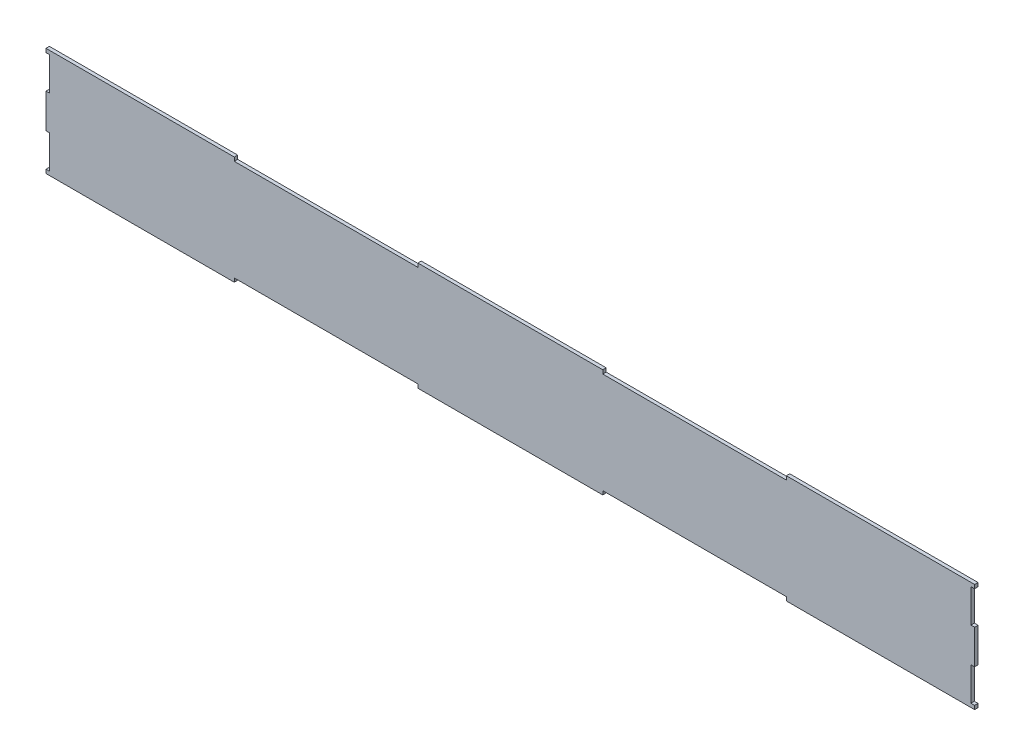
from build123d import *

# Parameters (mm, degrees)
BOSS_EXTRUDE1_DEPTH = 1.6


with BuildPart() as part:
    # Sketch1 → Boss-Extrude1 (new body)
    with BuildSketch(Plane.XY):
        Polygon((-218.4266645, 25.51), (-216.6666645, 25.51), (-129.8399987, 25.51), (-129.8399987, 23.75), (-43.4933329, 23.75), (-43.4933329, 25.51), (43.4933329, 25.51), (43.4933329, 23.75), (129.8399987, 23.75), (129.8399987, 25.51), (216.6666645, 25.51), (218.4266645, 25.51), (218.4266645, 23.75), (216.6666645, 23.75), (216.6666645, 8.076666667), (218.4266645, 8.076666667), (218.4266645, 0), (216.6666645, 0), (0, 0), (-216.6666645, 0), (-218.4266645, 0), (-218.4266645, 8.076666667), (-216.6666645, 8.076666667), (-216.6666645, 23.75), (-218.4266645, 23.75), align=None)
    boss_extrude1 = extrude(amount=BOSS_EXTRUDE1_DEPTH)

    # Mirror4: Boss-Extrude1 across plane
    add(boss_extrude1.mirror(Plane(origin=(0, 0, 1.6), x_dir=(0, 0, 1), z_dir=(0, 1, 0))))


solid = part.part
